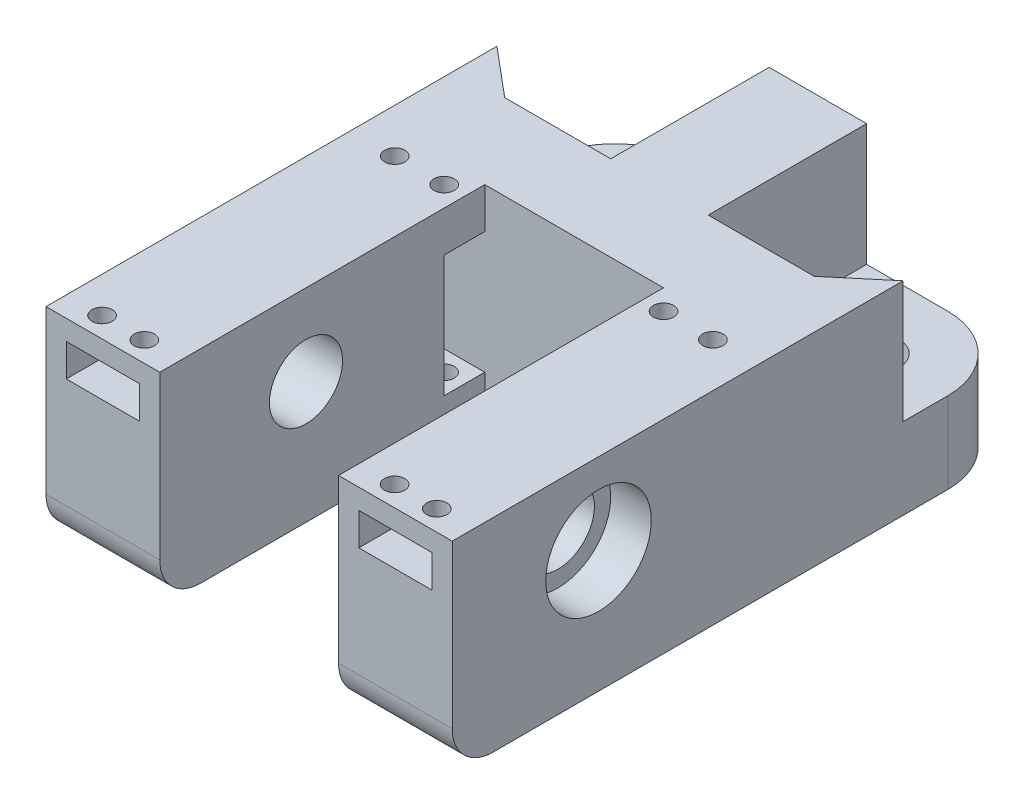
from build123d import *

# Parameters (mm, degrees)
SKETCH_1_W               = 50
SKETCH_1_H               = 25
EXTRUDE_1_DEPTH          = 70
SKETCH_2_W               = 22
SKETCH_2_H               = 25
CUT_EXTRUDE_1_DEPTH      = 40
SKETCH_3_R               = 4.5
CUT_EXTRUDE_2_DEPTH      = 50
SKETCH_4_R               = 6.5
CUT_EXTRUDE_4_DEPTH      = 5
SKETCH_5_R               = 3
CUT_EXTRUDE_5_DEPTH      = 29
CUT_EXTRUDE_6_DEPTH      = 5
CUT_EXTRUDE_6_DEPTH_BACK = 15
SKETCH_7_W               = 5
SKETCH_7_H               = 15
CUT_EXTRUDE_7_DEPTH      = 10
CUT_EXTRUDE_START        = -10
SKETCH_8_R               = 1.25
CUT_EXTRUDE_8_DEPTH      = 40
SKETCH_9_R               = 2.75
CUT_EXTRUDE_9_DEPTH      = 3
FILLET_2_R               = 5
SKETCH_10_W              = 9
SKETCH_10_H              = 4
CUT_EXTRUDE_10_DEPTH     = 5
SKETCH_12_R              = 1.25
CUT_EXTRUDE_11_DEPTH     = 10


with BuildPart() as part:
    # 스케치1 → 보스-돌출1 (new body)
    with BuildSketch(Plane.XY):
        Rectangle(SKETCH_1_W, SKETCH_1_H)
    extrude(amount=EXTRUDE_1_DEPTH)

    # 스케치2 → 컷-돌출1 (cut)
    with BuildSketch(Plane.XY.offset(70)):
        Rectangle(SKETCH_2_W, SKETCH_2_H)
    extrude(amount=-CUT_EXTRUDE_1_DEPTH, mode=Mode.SUBTRACT)

    # 스케치3 → 컷-돌출2 (cut)
    with BuildSketch(Plane(origin=(25, 0, 0), x_dir=(0, 0, -1), z_dir=(1, 0, 0))):
        with Locations((-52, 2.5)):
            Circle(SKETCH_3_R)
    extrude(amount=-CUT_EXTRUDE_2_DEPTH, mode=Mode.SUBTRACT)

    # 스케치4 → 컷-돌출4 (cut)
    with BuildSketch(Plane.ZY.offset(-25)):
        with Locations((52, 2.5)):
            Circle(SKETCH_4_R)
    cut_extrude_4 = extrude(amount=CUT_EXTRUDE_4_DEPTH, mode=Mode.SUBTRACT)

    # 스케치5 → 컷-돌출5 (cut)
    with BuildSketch(Plane(origin=(0, 12.5, 0), x_dir=(1, 0, 0), z_dir=(0, 1, 0))):
        with Locations((16, -9)):
            Circle(SKETCH_5_R)
        with BuildLine():
            Line((16, 12.355747981), (16, 0))
            ThreePointArc((16, 0), (22.363961031, -2.636038969), (25, -9))
            Line((25, -9), (37.355747981, -9))
            ThreePointArc((37.355747981, -9), (31.100794214, 6.100794214), (16, 12.355747981))
        make_face()
    cut_extrude_5 = extrude(amount=-CUT_EXTRUDE_5_DEPTH, mode=Mode.SUBTRACT)

    # 대칭 복사2: 컷-돌출4, 컷-돌출5 across plane
    add(cut_extrude_4.mirror(Plane(origin=(0, 0, 0), x_dir=(0, 0, 1), z_dir=(1, 0, 0))), mode=Mode.SUBTRACT)
    add(cut_extrude_5.mirror(Plane(origin=(0, 0, 0), x_dir=(0, 0, 1), z_dir=(1, 0, 0))), mode=Mode.SUBTRACT)

    # 스케치6 → 컷-돌출6 (cut, two sides: drawn at the far end of the back side and taken through both)
    with BuildSketch(Plane(origin=(0, 12.5, 0), x_dir=(1, 0, 0), z_dir=(0, 1, 0)).offset(-CUT_EXTRUDE_6_DEPTH_BACK)):
        Polygon((6, -19.5), (6, 5.258137662), (25, 5.258137662), (25, -14.502176213), (19.043825546, -19.5), align=None)
        Polygon((-25, -14.502176213), (-25, 5.258137662), (-6, 5.258137662), (-6, -19.5), (-19.043825546, -19.5), align=None)
    extrude(amount=CUT_EXTRUDE_6_DEPTH + CUT_EXTRUDE_6_DEPTH_BACK, mode=Mode.SUBTRACT)

    # 스케치7 → 컷-돌출7 (cut)
    with BuildSketch(Plane(origin=(-11, 0, 0), x_dir=(0, 0, -1), z_dir=(1, 0, 0))):
        with Locations((-32.5, 0)):
            Rectangle(SKETCH_7_W, SKETCH_7_H)
    cut_extrude_7 = extrude(amount=-CUT_EXTRUDE_7_DEPTH, mode=Mode.SUBTRACT)

    # 스케치8 → 컷-돌출8 (cut)
    with BuildSketch(Plane(origin=(0, -7.5, 0), x_dir=(1, 0, 0), z_dir=(0, 1, 0)).offset(CUT_EXTRUDE_START)):
        with Locations((-13.5, -32.5)):
            Circle(SKETCH_8_R)
        with Locations((-19.574812365, -32.5)):
            Circle(SKETCH_8_R)
    cut_extrude_8 = extrude(amount=CUT_EXTRUDE_8_DEPTH, mode=Mode.SUBTRACT)

    # 스케치9 → 컷-돌출9 (cut)
    with BuildSketch(Plane.XZ.offset(12.5)):
        with Locations((-19.574812365, 32.5)):
            Circle(SKETCH_9_R)
        with Locations((-13.5, 32.5)):
            Circle(SKETCH_9_R)
    cut_extrude_9 = extrude(amount=-CUT_EXTRUDE_9_DEPTH, mode=Mode.SUBTRACT)

    # 필렛2
    fillet_2_edges = [part.edges().sort_by_distance(p)[0] for p in [
        (18, -12.5, 70),
        (-18, -12.5, 70),
    ]]
    fillet(fillet_2_edges, radius=FILLET_2_R)

    # 스케치10 → 컷-돌출10 (cut)
    with BuildSketch(Plane.XY.offset(70)):
        with Locations((-18, 8.036191449)):
            Rectangle(SKETCH_10_W, SKETCH_10_H)
    cut_extrude_10 = extrude(amount=-CUT_EXTRUDE_10_DEPTH, mode=Mode.SUBTRACT)

    # 스케치12 → 컷-돌출11 (cut)
    with BuildSketch(Plane.XZ.offset(-10.036191449)):
        with Locations((-15.400835213, 67.5)):
            Circle(SKETCH_12_R)
        with Locations((-20.599164787, 67.5)):
            Circle(SKETCH_12_R)
    cut_extrude_11 = extrude(amount=-CUT_EXTRUDE_11_DEPTH, mode=Mode.SUBTRACT)

    # 대칭 복사3: 컷-돌출7, 컷-돌출8, 컷-돌출9, 컷-돌출10, 컷-돌출11 across plane
    add(cut_extrude_7.mirror(Plane(origin=(0, 0, 0), x_dir=(0, 0, 1), z_dir=(1, 0, 0))), mode=Mode.SUBTRACT)
    add(cut_extrude_8.mirror(Plane(origin=(0, 0, 0), x_dir=(0, 0, 1), z_dir=(1, 0, 0))), mode=Mode.SUBTRACT)
    add(cut_extrude_9.mirror(Plane(origin=(0, 0, 0), x_dir=(0, 0, 1), z_dir=(1, 0, 0))), mode=Mode.SUBTRACT)
    add(cut_extrude_10.mirror(Plane(origin=(0, 0, 0), x_dir=(0, 0, 1), z_dir=(1, 0, 0))), mode=Mode.SUBTRACT)
    add(cut_extrude_11.mirror(Plane(origin=(0, 0, 0), x_dir=(0, 0, 1), z_dir=(1, 0, 0))), mode=Mode.SUBTRACT)


solid = part.part
